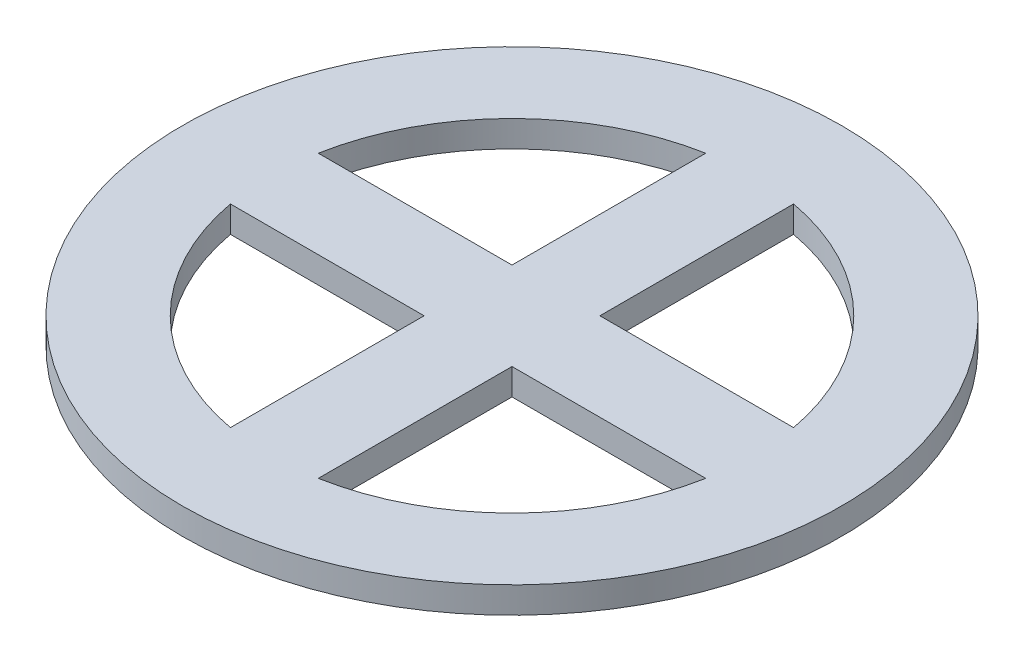
from build123d import *

# Parameters (mm, degrees)
ESBO_O1_R                = 75
RESSALTO_EXTRUS_O1_DEPTH = 6


with BuildPart() as part:
    # Esboço1 → Ressalto-extrusão1 (new body)
    with BuildSketch(Plane(origin=(0, 0, 0), x_dir=(1, 0, 0), z_dir=(0, 1, 0))):
        Circle(ESBO_O1_R)
        with BuildLine():
            Line((-10, 10), (-54.083269132, 10))
            ThreePointArc((-54.083269132, 10), (-38.890872965, 38.890872965), (-10, 54.083269132))
            Line((-10, 54.083269132), (-10, 10))
        make_face(mode=Mode.SUBTRACT)
        with BuildLine():
            Line((-54.083269132, -10), (-10, -10))
            Line((-10, -10), (-10, -54.083269132))
            ThreePointArc((-10, -54.083269132), (-38.890872965, -38.890872965), (-54.083269132, -10))
        make_face(mode=Mode.SUBTRACT)
        with BuildLine():
            ThreePointArc((54.083269132, -10), (38.890872965, -38.890872965), (10, -54.083269132))
            Line((10, -54.083269132), (10, -10))
            Line((10, -10), (54.083269132, -10))
        make_face(mode=Mode.SUBTRACT)
        with BuildLine():
            ThreePointArc((10, 54.083269132), (38.890872965, 38.890872965), (54.083269132, 10))
            Line((54.083269132, 10), (10, 10))
            Line((10, 10), (10, 54.083269132))
        make_face(mode=Mode.SUBTRACT)
    extrude(amount=RESSALTO_EXTRUS_O1_DEPTH)


solid = part.part
